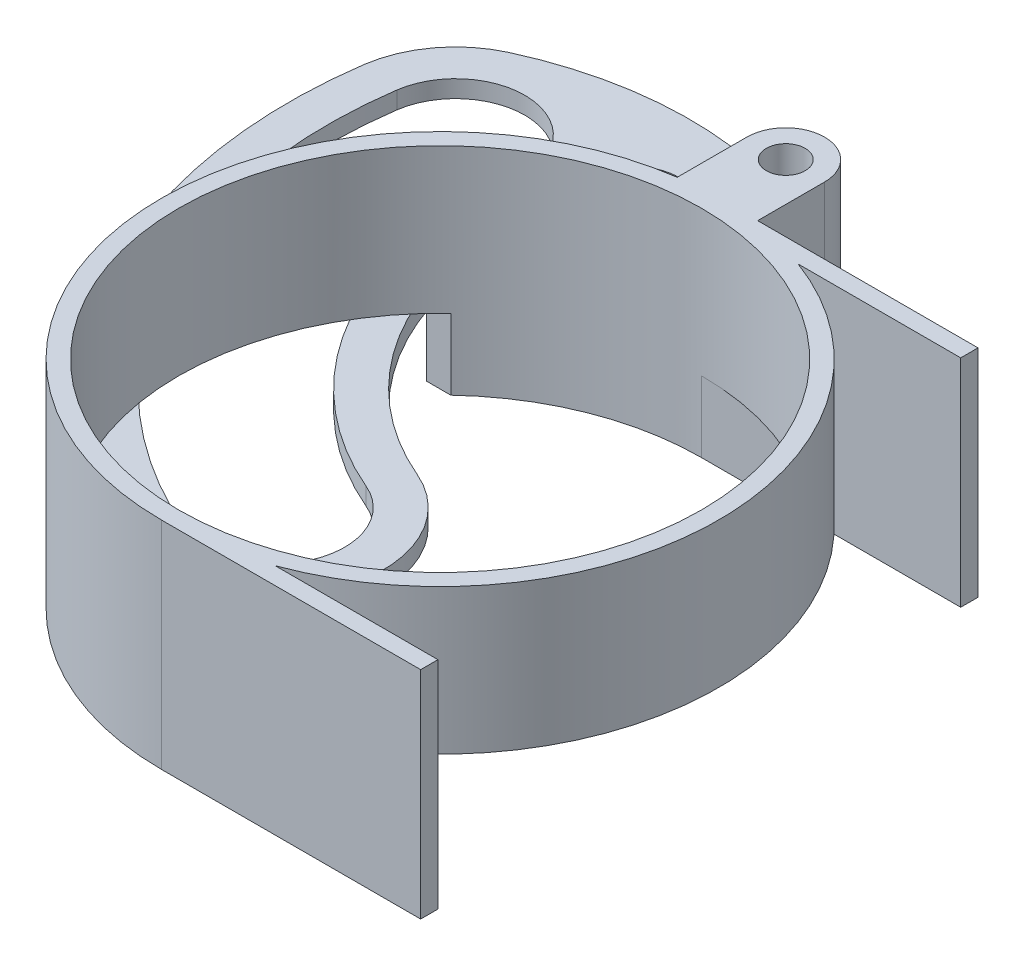
from build123d import *

# Parameters (mm, degrees)
SKETCH1_R           = 32.25
SKETCH1_R_2         = 30.25
BOSS_EXTRUDE1_DEPTH = 25
CUT_EXTRUDE1_DEPTH  = 8.2
BOSS_EXTRUDE2_DEPTH = 2
FILLET1_R           = 5
SKETCH4_R           = 2
BOSS_EXTRUDE3_DEPTH = 15
CHAMFER1_SIZE       = 1
BOSS_EXTRUDE4_START = -22.6
SKETCH5_R           = 2.25
BOSS_EXTRUDE4_DEPTH = 22.6
SKETCH6_W           = 30
SKETCH6_H           = 2
BOSS_EXTRUDE5_DEPTH = 25


with BuildPart() as part:
    # Sketch1 → Boss-Extrude1 (new body)
    with BuildSketch(Plane(origin=(0, 0, 0), x_dir=(1, 0, 0), z_dir=(0, 1, 0))):
        with Locations(Location((0, 0, 0), (0, 0, 270))):
            Circle(SKETCH1_R)
        with Locations(Location((0, 0, 0), (0, 0, 270))):
            Circle(SKETCH1_R_2, mode=Mode.SUBTRACT)
    extrude(amount=BOSS_EXTRUDE1_DEPTH)

    # Sketch2 → Cut-Extrude1 (cut)
    with BuildSketch(Plane(origin=(0, 0, 0), x_dir=(1, 0, 0), z_dir=(0, 1, 0))):
        Polygon((0, -12), (0, -30.25), (38.638720052, -30.25), (38.638720052, 30.25), (0, 30.25), (0, 22), (-36.204186746, 22), (-36.204186746, -12), align=None)
    extrude(amount=CUT_EXTRUDE1_DEPTH, mode=Mode.SUBTRACT)

    # Sketch5 → Boss-Extrude4 (add)
    with BuildSketch(Plane(origin=(0, 25, 0), x_dir=(1, 0, 0), z_dir=(0, 1, 0)).offset(BOSS_EXTRUDE4_START)):
        with BuildLine():
            Line((-4.5, 40), (-4.5, 31.934503284))
            ThreePointArc((-4.5, 31.934503284), (0, 32.25), (4.5, 31.934503284))
            Line((4.5, 31.934503284), (4.5, 40))
            ThreePointArc((4.5, 40), (0, 44.5), (-4.5, 40))
        make_face()
        with Locations(Location((0, 40, 0), (0, 0, 270))):
            Circle(SKETCH5_R, mode=Mode.SUBTRACT)
    extrude(amount=BOSS_EXTRUDE4_DEPTH)

    # Sketch6 → Boss-Extrude5 (add)
    with BuildSketch(Plane.XZ):
        with Locations((15, -31.25)):
            Rectangle(SKETCH6_W, SKETCH6_H)
    boss_extrude5 = extrude(amount=-BOSS_EXTRUDE5_DEPTH)

    # Mirror1: Boss-Extrude5 across plane
    add(boss_extrude5.mirror(Plane.XY))


with BuildPart() as body_2:
    # Sketch3 → Boss-Extrude2 (new body)
    with BuildSketch(Plane(origin=(0, 0, 0), x_dir=(1, 0, 0), z_dir=(0, 1, 0))):
        with BuildLine():
            ThreePointArc((-56.925093776, 48.110715046), (-50.099203776, 11.78086144), (-22.567647546, -12.886210719))
            ThreePointArc((-22.567647546, -12.886210719), (-6.16463488, -6.295218725), (-12.755626874, 10.107793941))
            ThreePointArc((-12.755626874, 10.107793941), (-28.316941264, 24.050052118), (-32.175053004, 44.5843172))
            ThreePointArc((-32.175053004, 44.5843172), (-32.723387933, 50.394676991), (-35.84982313, 55.322795807))
            ThreePointArc((-35.84982313, 55.322795807), (-16.777592276, 51.693621977), (-2.57365586, 38.458476237))
            ThreePointArc((-2.57365586, 38.458476237), (1.541523763, 37.42634414), (2.57365586, 41.541523763))
            ThreePointArc((2.57365586, 41.541523763), (-20.513652026, 59.652200656), (-49.791491149, 57.695535328))
            ThreePointArc((-49.791491149, 57.695535328), (-54.577631328, 53.810630876), (-56.925093776, 48.110715046))
        make_face()
        with BuildLine():
            ThreePointArc((-52.470086437, 47.475963434), (-46.178396524, 13.989315762), (-20.801483825, -8.74728988))
            ThreePointArc((-20.801483825, -8.74728988), (-10.303555719, -4.529055004), (-14.521790595, 5.968873102))
            ThreePointArc((-14.521790595, 5.968873102), (-32.237748516, 21.841597796), (-36.630060343, 45.219068812))
            ThreePointArc((-36.630060343, 45.219068812), (-43.421626079, 54.26752917), (-52.470086437, 47.475963434))
        make_face(mode=Mode.SUBTRACT)
    extrude(amount=BOSS_EXTRUDE2_DEPTH)

    # Fillet1
    fillet1_edges = [body_2.edges().sort_by_distance(p)[0] for p in [
        (-35.84982313, 1, -55.322795807),
    ]]
    fillet(fillet1_edges, radius=FILLET1_R)

    # Sketch4 → Boss-Extrude3 (add)
    with BuildSketch(Plane(origin=(0, 2, 0), x_dir=(1, 0, 0), z_dir=(0, 1, 0))):
        with Locations(Location((0, 40, 0), (0, 0, 270))):
            Circle(SKETCH4_R)
    extrude(amount=BOSS_EXTRUDE3_DEPTH)

    # Chamfer1
    chamfer1_edges = [body_2.edges().sort_by_distance(p)[0] for p in [
        (0, 17, -42),
    ]]
    chamfer(chamfer1_edges, length=CHAMFER1_SIZE)


solid = Compound([part.part, body_2.part])
